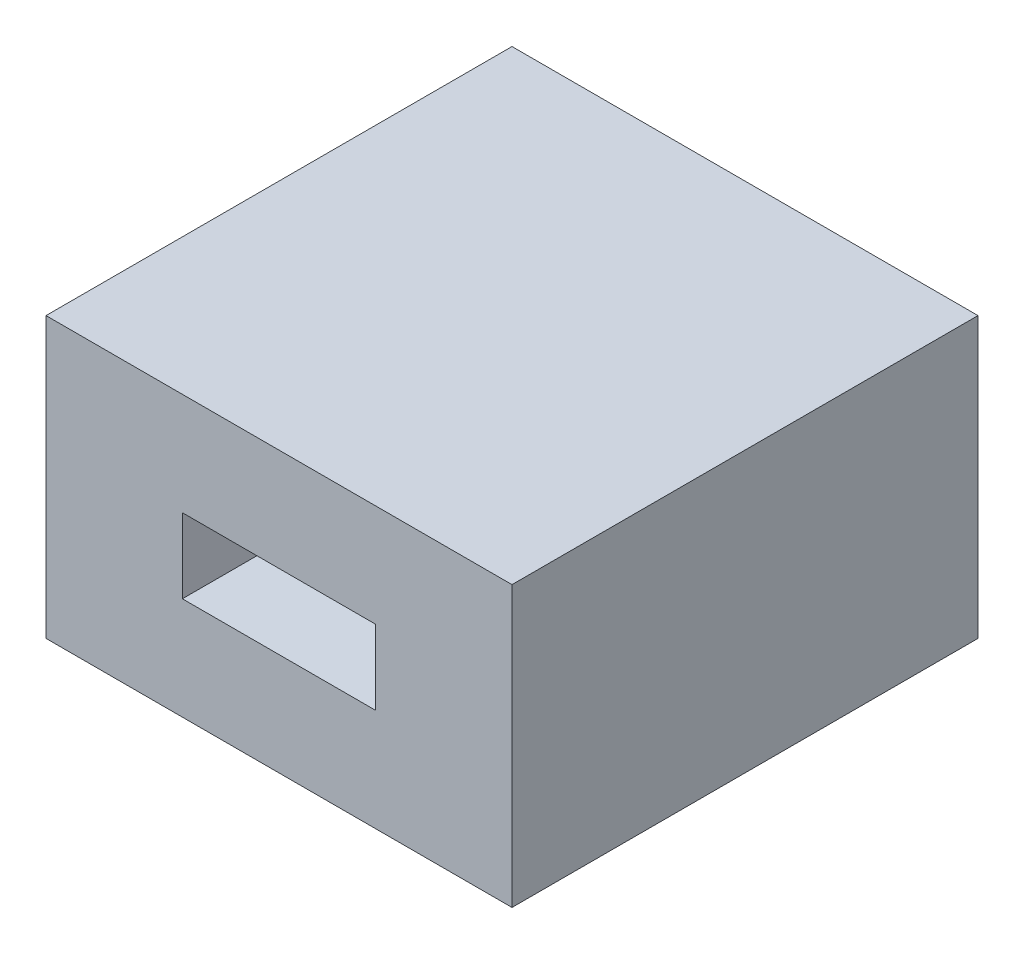
from build123d import *

# Parameters (mm, degrees)
SKETCH1_W           = 25
SKETCH1_H           = 25
BOSS_EXTRUDE1_DEPTH = 15
SKETCH2_W           = 10.366354442
SKETCH2_H           = 4
CUT_EXTRUDE1_DEPTH  = 24
CUT_EXTRUDE1_DRAFT  = -3.5


with BuildPart() as part:
    # Sketch1 → Boss-Extrude1 (new body)
    with BuildSketch(Plane(origin=(0, 0, 0), x_dir=(1, 0, 0), z_dir=(0, 1, 0))):
        Rectangle(SKETCH1_W, SKETCH1_H)
    extrude(amount=BOSS_EXTRUDE1_DEPTH)


with BuildPart() as cut_extrude1_tool:
    # Sketch2 → Cut-Extrude1 (with draft: the straight prism first)
    with BuildSketch(Plane.XY.offset(12.5)):
        with Locations((0, 7.5)):
            Rectangle(SKETCH2_W, SKETCH2_H)
    extrude(amount=-CUT_EXTRUDE1_DEPTH)
    # Cut-Extrude1: the draft: its side faces are tilted about the plane it starts from
    cut_extrude1_sides = [cut_extrude1_tool.faces().sort_by_distance(p)[0] for p in [
        (-5.183177221, 7.5, 0.5),
        (0, 5.5, 0.5),
        (5.183177221, 7.5, 0.5),
        (0, 9.5, 0.5),
    ]]
    draft(cut_extrude1_sides, Plane.XY.offset(12.5), CUT_EXTRUDE1_DRAFT)


with BuildPart() as part_1:
    add(part.part)

    # Cut-Extrude1: cut by cut_extrude1_tool
    add(cut_extrude1_tool.part, mode=Mode.SUBTRACT)


solid = part_1.part
